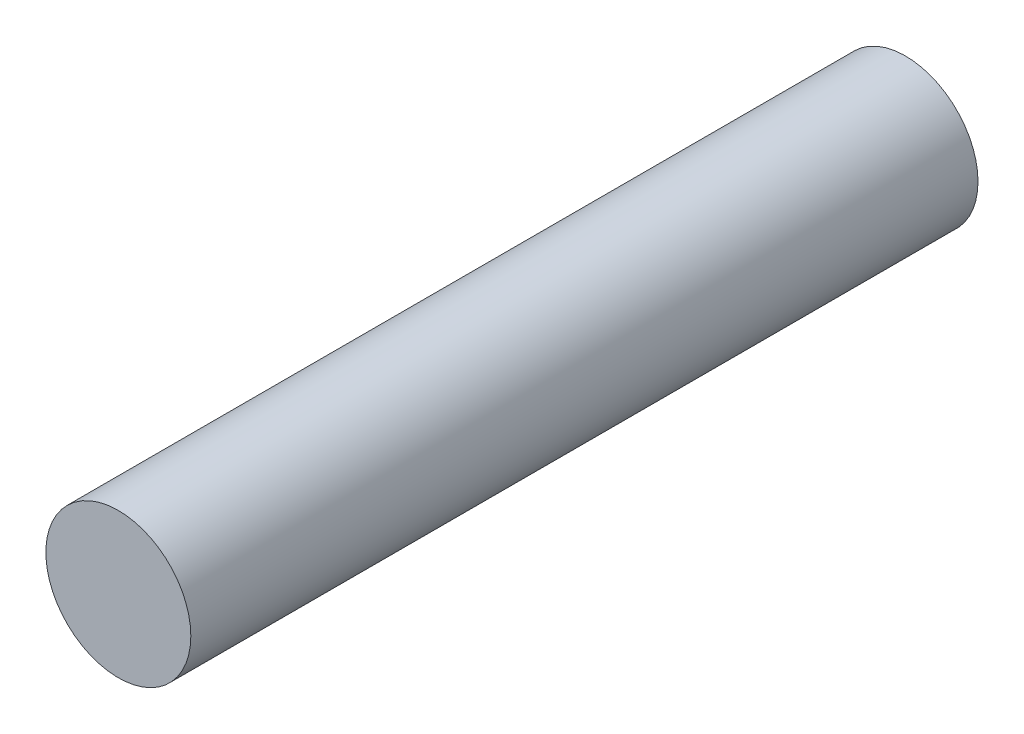
from build123d import *

# Parameters (mm, degrees)
SKETCH1_R           = 12.7
BOSS_EXTRUDE1_DEPTH = 137.922


with BuildPart() as part:
    # Sketch1 → Boss-Extrude1 (new body)
    with BuildSketch(Plane.XY):
        Circle(SKETCH1_R)
    extrude(amount=BOSS_EXTRUDE1_DEPTH)


solid = part.part
